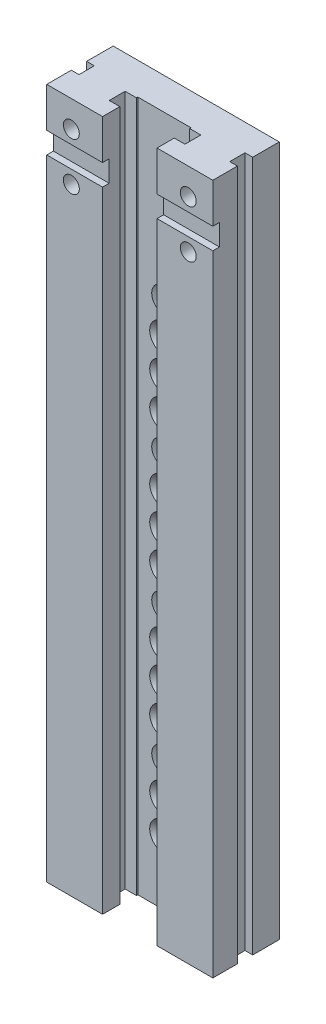
from build123d import *

# Parameters (mm, degrees)
BOSS_EXTRUDE1_DEPTH                      = 520
CUT_EXTRUDE1_REACH                       = 528.124
SKETCH4_W                                = 40
SKETCH4_H                                = 1
CBORE_FOR_M12_HEX_HEAD_BOLT1_D           = 13
CBORE_FOR_M12_HEX_HEAD_BOLT1_CBORE_D     = 19
CBORE_FOR_M12_HEX_HEAD_BOLT1_CBORE_DEPTH = 12
LPATTERN1_COUNT                          = 4
LPATTERN1_PITCH                          = 100
LPATTERN2_COUNT                          = 14
LPATTERN2_PITCH                          = 25
SKETCH7_W                                = 5
SKETCH7_H                                = 16
CUT_EXTRUDE2_DEPTH                       = 538.145231758
LPATTERN3_COUNT                          = 2
LPATTERN3_PITCH                          = 88
LPATTERN3_COUNT_DIR2                     = 2
LPATTERN3_PITCH_DIR2                     = 36


with BuildPart() as part:
    # Sketch1 → Boss-Extrude1 (new body)
    with BuildSketch(Plane(origin=(0, 0, 0), x_dir=(1, 0, 0), z_dir=(0, 1, 0))):
        Polygon((62.5, 0), (-62.5, 0), (-62.5, -20), (-56.7, -20), (-56.7, -31.5), (-62.5, -31.5), (-62.5, -50), (-20.5, -50), (-20.5, -37), (-28.5, -37), (-28.5, -25), (28.5, -25), (28.5, -37), (20.5, -37), (20.5, -50), (62.5, -50), (62.5, -31.5), (56.7, -31.5), (56.7, -20), (62.5, -20), align=None)
    extrude(amount=-BOSS_EXTRUDE1_DEPTH)

    # Sketch4 → Cut-Extrude1 (cut, up to next)
    with BuildSketch(Plane(origin=(0, 0, 0), x_dir=(1, 0, 0), z_dir=(0, 1, 0)), mode=Mode.PRIVATE) as cut_extrude1_sk1:
        with Locations((0, -24.5)):
            Rectangle(SKETCH4_W, SKETCH4_H)
    cut_extrude1_tool1 = extrude(cut_extrude1_sk1.sketch, amount=-CUT_EXTRUDE1_REACH, mode=Mode.PRIVATE) & part.part
    add(cut_extrude1_tool1.solids().sort_by_distance((0, 0, 24.5))[0], mode=Mode.SUBTRACT)

    # CBORE for M12 Hex Head Bolt1 (through all)
    with Locations(Plane.XY.offset(25)):
        with Locations((0, -122.5)):
            cbore_for_m12_hex_head_bolt1 = CounterBoreHole(CBORE_FOR_M12_HEX_HEAD_BOLT1_D / 2, CBORE_FOR_M12_HEX_HEAD_BOLT1_CBORE_D / 2, CBORE_FOR_M12_HEX_HEAD_BOLT1_CBORE_DEPTH)

    # LPattern1: CBORE for M12 Hex Head Bolt1 ×4
    with Locations(*[(0, -i * LPATTERN1_PITCH, 0) for i in range(1, LPATTERN1_COUNT)]):
        add(cbore_for_m12_hex_head_bolt1, mode=Mode.SUBTRACT)

    # Sketch6 → CSK for M10 Countersunk Flat Head Screw1 (revolve, cut)
    with BuildSketch(Plane(origin=(0, -147.5, 24), x_dir=(0, -1, 0), z_dir=(1, 0, 0))):
        Polygon((0, 0), (0, 14.304733405), (5.5, 11), (5.5, 5.5), (11, 0), align=None)
    csk_for_m10_countersunk_flat_head_screw1 = revolve(axis=Axis((0, -147.5, 30.35), (0, 0, -1)), mode=Mode.SUBTRACT)

    # LPattern2: CSK for M10 Countersunk Flat Head Screw1 ×14, 3 skipped
    with Locations(*[(0, -i * LPATTERN2_PITCH, 0) for i in range(1, LPATTERN2_COUNT) if i not in (3, 7, 11)]):
        add(csk_for_m10_countersunk_flat_head_screw1, mode=Mode.SUBTRACT)

    # Sketch7 → Cut-Extrude2 (cut, through all)
    with BuildSketch(Plane(origin=(62.5, 0, 0), x_dir=(0, 0, -1), z_dir=(1, 0, 0))):
        with Locations((-47.5, -38)):
            Rectangle(SKETCH7_W, SKETCH7_H)
    extrude(amount=-CUT_EXTRUDE2_DEPTH, mode=Mode.SUBTRACT)

    # Sketch9 → M14 Tapped Hole1 (revolve, cut)
    with BuildSketch(Plane(origin=(44, -20, 50), x_dir=(0, -1, 0), z_dir=(1, 0, 0))):
        Polygon((0, 0), (0, 39.605163714), (6, 36), (6, 0), align=None)
    m14_tapped_hole1 = revolve(axis=Axis((44, -20, 56.35), (0, 0, -1)), mode=Mode.SUBTRACT)

    # LPattern3: M14 Tapped Hole1 2 × 2
    with Locations(*[(-i * LPATTERN3_PITCH, -j * LPATTERN3_PITCH_DIR2, 0) for i in range(LPATTERN3_COUNT) for j in range(LPATTERN3_COUNT_DIR2) if (i, j) != (0, 0)]):
        add(m14_tapped_hole1, mode=Mode.SUBTRACT)


solid = part.part
